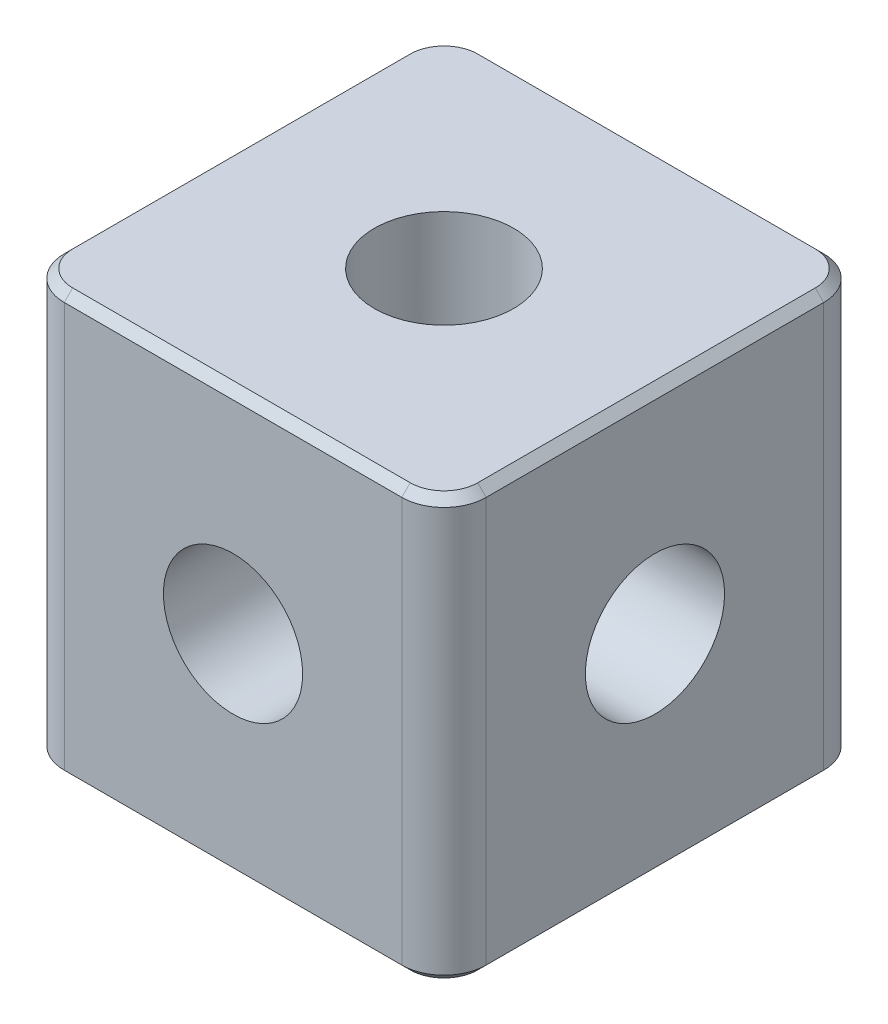
from build123d import *

# Parameters (mm, degrees)
SKETCH_1_W         = 10
SKETCH_1_H         = 10
EXTRUDE_1_DEPTH    = 5
HOLE_WIZARD_M4_1_D = 3.3
HOLE_WIZARD_M4_3_D = 3.3
HOLE_WIZARD_M4_2_D = 3.3
FILLET_1_R         = 1
CHAMFER_1_SIZE     = 0.2


with BuildPart() as part:
    # 草图1 → 凸台-拉伸1 (new, symmetric)
    with BuildSketch(Plane(origin=(0, 0, 0), x_dir=(1, 0, 0), z_dir=(0, 1, 0))):
        Rectangle(SKETCH_1_W, SKETCH_1_H)
    extrude(amount=EXTRUDE_1_DEPTH, both=True)

    # M4 螺纹孔1 (through all)
    with Locations(Plane(origin=(0, 5, 0), x_dir=(1, 0, 0), z_dir=(0, 1, 0))):
        with Locations((0, 0)):
            Hole(HOLE_WIZARD_M4_1_D / 2)

    # M4 螺纹孔3 (through all)
    with Locations(Plane.XY.offset(5)):
        with Locations((0, 0)):
            Hole(HOLE_WIZARD_M4_3_D / 2)

    # M4 螺纹孔2 (through all)
    with Locations(Plane(origin=(5, 0, 0), x_dir=(0, 0, -1), z_dir=(1, 0, 0))):
        with Locations((0, 0)):
            Hole(HOLE_WIZARD_M4_2_D / 2)

    # 圆角1
    fillet_1_edges = [part.edges().sort_by_distance(p)[0] for p in [
        (5, 0, 5),
        (-5, 0, 5),
        (-5, 0, -5),
        (5, 0, -5),
    ]]
    fillet(fillet_1_edges, radius=FILLET_1_R)

    # 倒角1
    chamfer_1_edges = [part.edges().sort_by_distance(p)[0] for p in [
        (0, -5, -5),
        (0, 5, -5),
        (5, -5, 0),
        (0, -5, 5),
        (-5, -5, 0),
        (-4.707106781, -5, -4.707106781),
        (-4.707106781, -5, 4.707106781),
        (4.707106781, -5, 4.707106781),
        (4.707106781, -5, -4.707106781),
        (5, 5, 0),
        (-5, 5, 0),
        (0, 5, 5),
        (-4.707106781, 5, -4.707106781),
        (-4.707106781, 5, 4.707106781),
        (4.707106781, 5, 4.707106781),
        (4.707106781, 5, -4.707106781),
    ]]
    chamfer(chamfer_1_edges, length=CHAMFER_1_SIZE)


solid = part.part
